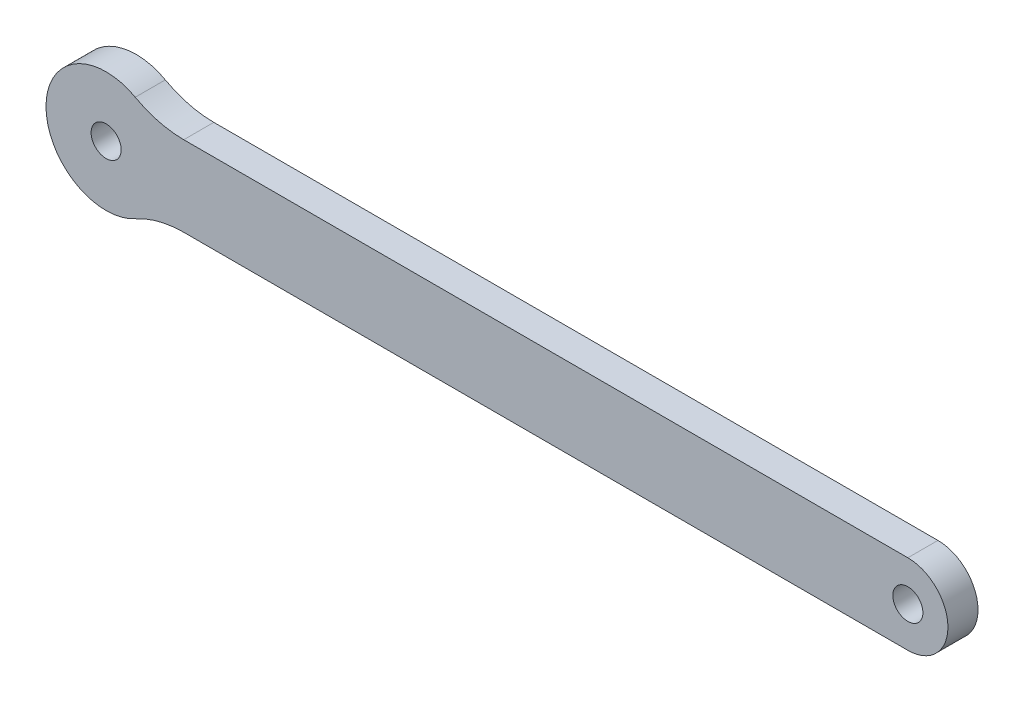
from build123d import *

# Parameters (mm, degrees)
ESQUISSE15_R        = 1.5
BOSS_EXTRU_15_DEPTH = 3


with BuildPart() as part:
    # Esquisse15 → Boss.-Extru.15 (new body)
    with BuildSketch(Plane.XY):
        with BuildLine():
            Line((198.647142503, 65.56420703), (126.393109195, 65.56420703))
            ThreePointArc((126.393109195, 65.56420703), (123.893109195, 65.881748664), (121.551880013, 66.81420703))
            ThreePointArc((121.551880013, 66.81420703), (112.647142503, 61.56420703), (121.551880013, 56.31420703))
            ThreePointArc((121.551880013, 56.31420703), (123.893109195, 57.246665395), (126.393109195, 57.56420703))
            Line((126.393109195, 57.56420703), (198.647142503, 57.56420703))
            ThreePointArc((198.647142503, 57.56420703), (202.647142503, 61.56420703), (198.647142503, 65.56420703))
        make_face()
        with Locations((118.647142503, 61.56420703)):
            Circle(ESQUISSE15_R, mode=Mode.SUBTRACT)
        with Locations((198.647142503, 61.56420703)):
            Circle(ESQUISSE15_R, mode=Mode.SUBTRACT)
    extrude(amount=BOSS_EXTRU_15_DEPTH)


solid = part.part
